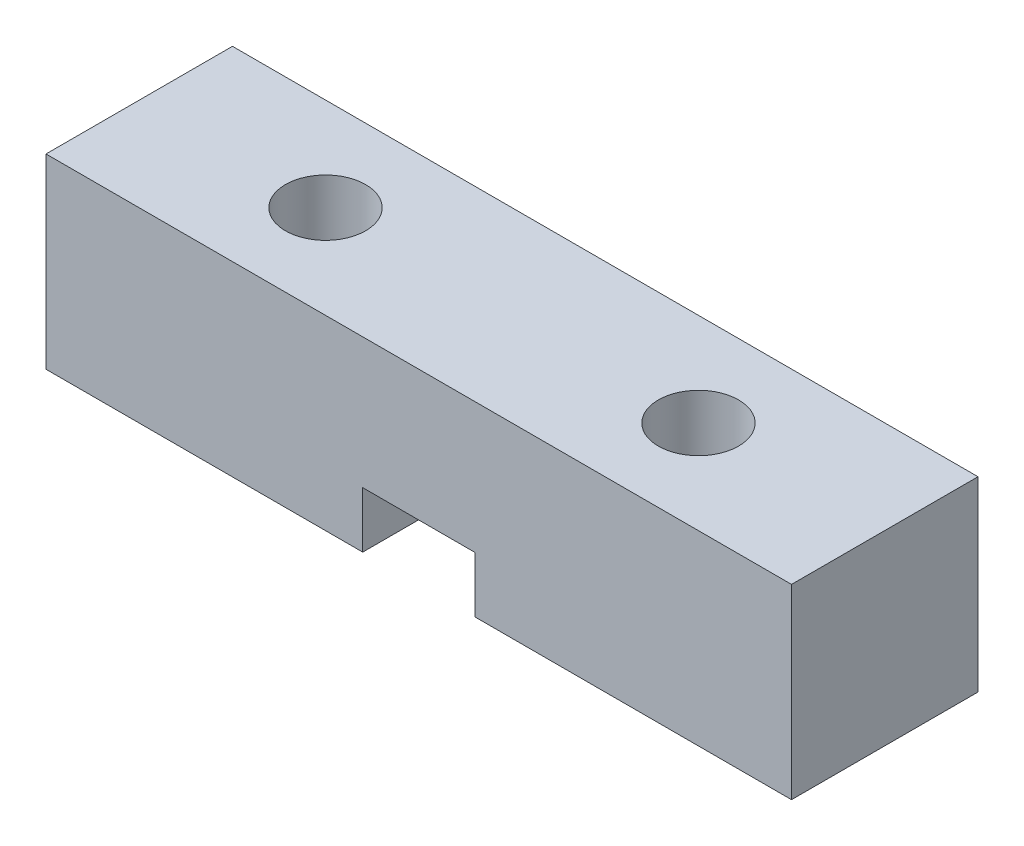
from build123d import *

# Parameters (mm, degrees)
BOSS_EXTRUDE1_DEPTH  = 10
M4_CLEARANCE_HOLE1_D = 4.3


with BuildPart() as part:
    # Sketch1 → Boss-Extrude1 (new body)
    with BuildSketch(Plane.XY):
        Polygon((54.99, 29.865), (15.01, 29.865), (15.01, 19.865), (31.995, 19.865), (31.995, 22.86), (38.005, 22.86), (38.005, 19.865), (54.99, 19.865), align=None)
    extrude(amount=-BOSS_EXTRUDE1_DEPTH)

    # M4 Clearance Hole1 (through all)
    with Locations(Plane(origin=(25, 19.865, -5), x_dir=(0, 0, -1), z_dir=(0, -1, 0))):
        with Locations((0, 0), (0, 20)):
            Hole(M4_CLEARANCE_HOLE1_D / 2)


solid = part.part
